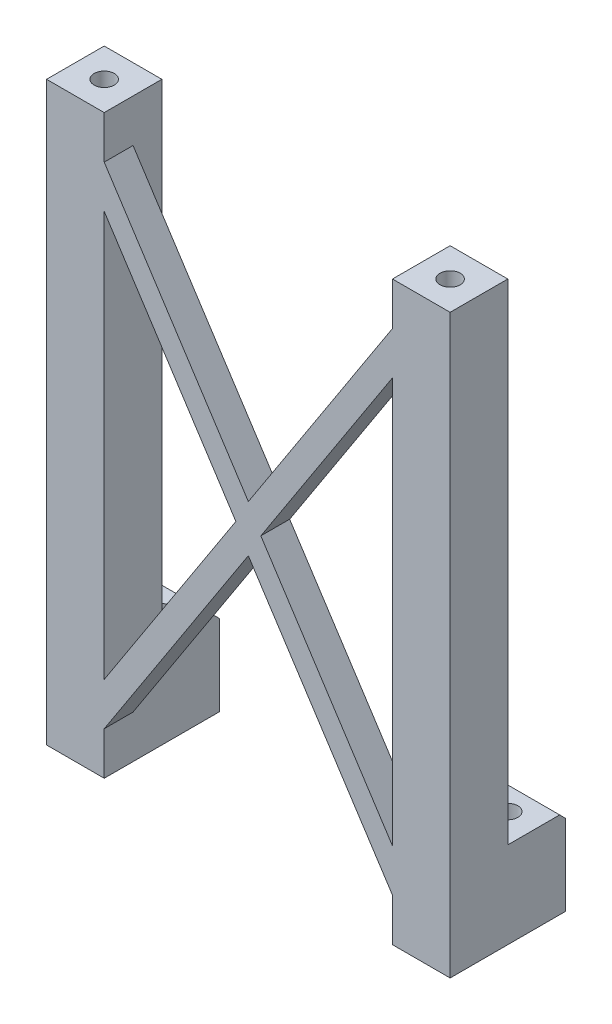
from build123d import *

# Parameters (mm, degrees)
CROQUIS3_W              = 10
CROQUIS3_H              = 10
CROQUIS3_R              = 1.75
SALIENTE_EXTRUIR1_DEPTH = 50
SALIENTE_EXTRUIR2_DEPTH = 5
CROQUIS9_W              = 10
CROQUIS9_H              = 10
CROQUIS9_R              = 1.75
SALIENTE_EXTRUIR4_DEPTH = 15
CHAFL_N1_SIZE           = 1


with BuildPart() as part:
    # Croquis3 → Saliente-Extruir1 (new body)
    with BuildSketch(Plane(origin=(0, 0, 0), x_dir=(1, 0, 0), z_dir=(0, 1, 0))):
        with Locations((30, 0)):
            Rectangle(CROQUIS3_W, CROQUIS3_H)
        with Locations(Location((30, 0, 0), (0, 0, 270))):
            Circle(CROQUIS3_R, mode=Mode.SUBTRACT)
    extrude(amount=SALIENTE_EXTRUIR1_DEPTH)

    # Croquis4 → Saliente-Extruir2 (add)
    with BuildSketch(Plane.XY):
        Polygon((0, 0), (0, 4.066369454), (25, 42.555355948), (25, 35.154579698), (2.165818783, 0), align=None)
    extrude(amount=SALIENTE_EXTRUIR2_DEPTH)

    # Simetría1: part across plane


with BuildPart() as part_1:
    add(part.part)
    add(part.part.mirror(Plane.ZX))

    # Croquis9 → Saliente-Extruir4 (add)
    with BuildSketch(Plane.XZ.offset(50)):
        with Locations((30, -10)):
            Rectangle(CROQUIS9_W, CROQUIS9_H)
        with Locations(Location((30, -10, 0), (0, 0, 270))):
            Circle(CROQUIS9_R, mode=Mode.SUBTRACT)
    extrude(amount=-SALIENTE_EXTRUIR4_DEPTH)

    # Chaflán1
    chafl_n1_edges = [part_1.edges().sort_by_distance(p)[0] for p in [
        (30, -35, -15),
    ]]
    chamfer(chafl_n1_edges, length=CHAFL_N1_SIZE)

    # Simetría2: part across plane


with BuildPart() as part_2:
    add(part_1.part)
    add(part_1.part.mirror(Plane(origin=(0, 0, 0), x_dir=(0, 0, 1), z_dir=(1, 0, 0))))


solid = part_2.part
